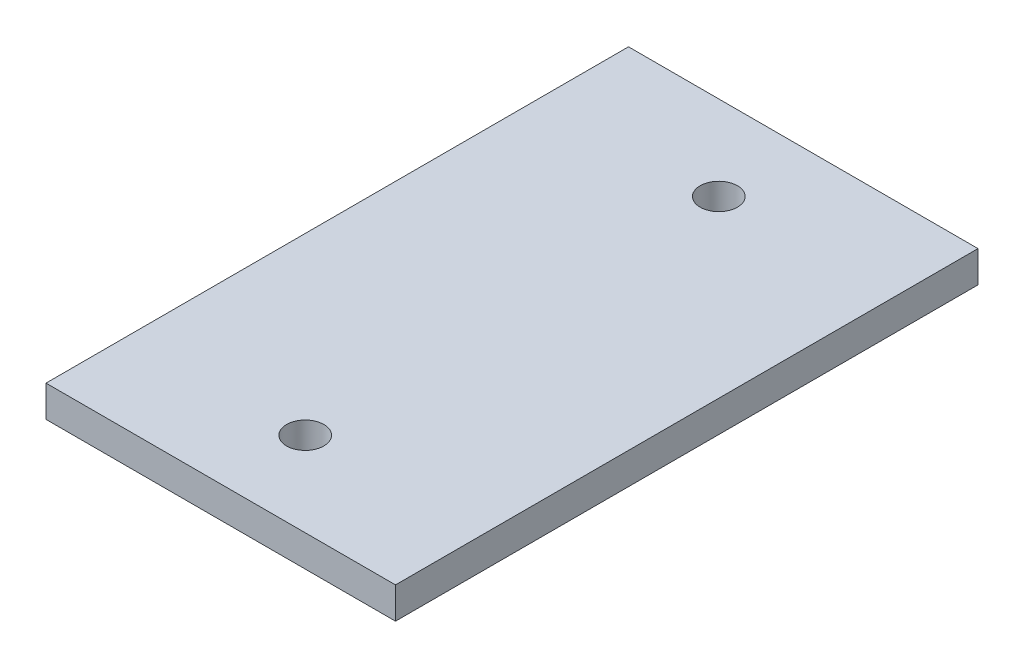
from build123d import *

# Parameters (mm, degrees)
SKETCH1_W           = 30
SKETCH1_H           = 50
SKETCH1_R           = 1.6
BOSS_EXTRUDE1_DEPTH = 2.7


with BuildPart() as part:
    # Sketch1 → Boss-Extrude1 (new body)
    with BuildSketch(Plane(origin=(0, 0, 0), x_dir=(1, 0, 0), z_dir=(0, 1, 0))):
        Rectangle(SKETCH1_W, SKETCH1_H)
        with Locations(Location((0, 17.75, 0), (0, 0, 90))):
            Circle(SKETCH1_R, mode=Mode.SUBTRACT)
        with Locations(Location((0, -17.75, 0), (0, 0, 90))):
            Circle(SKETCH1_R, mode=Mode.SUBTRACT)
    extrude(amount=BOSS_EXTRUDE1_DEPTH)


solid = part.part
